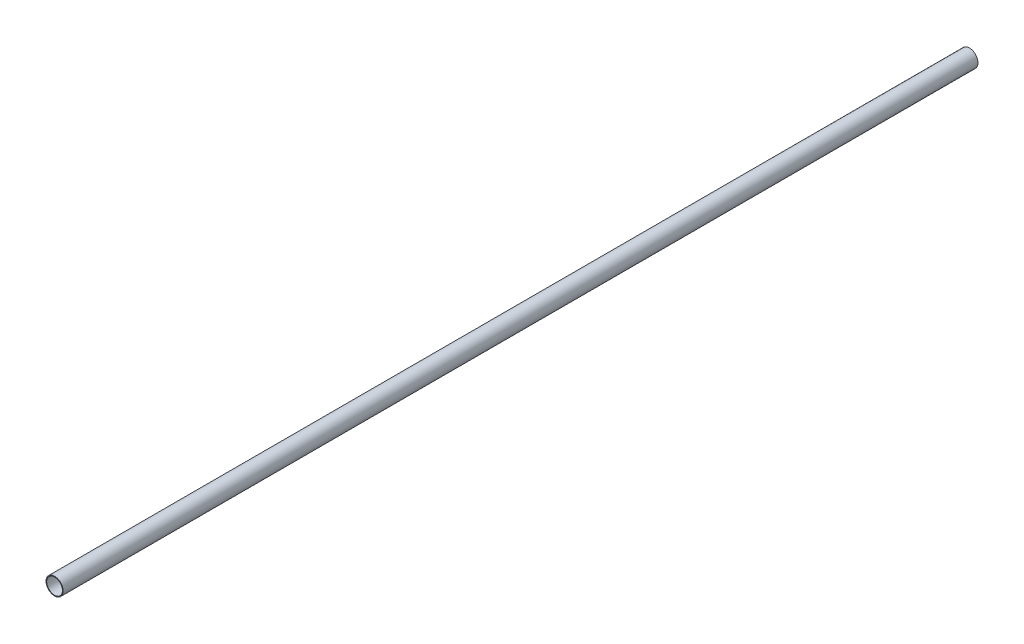
from build123d import *

# Parameters (mm, degrees)
SKETCH1_R           = 7.5
SKETCH1_R_2         = 6.9
BOSS_EXTRUDE1_DEPTH = 800


with BuildPart() as part:
    # Sketch1 → Boss-Extrude1 (new body)
    with BuildSketch(Plane.XY):
        Circle(SKETCH1_R)
        Circle(SKETCH1_R_2, mode=Mode.SUBTRACT)
    extrude(amount=BOSS_EXTRUDE1_DEPTH)


solid = part.part
